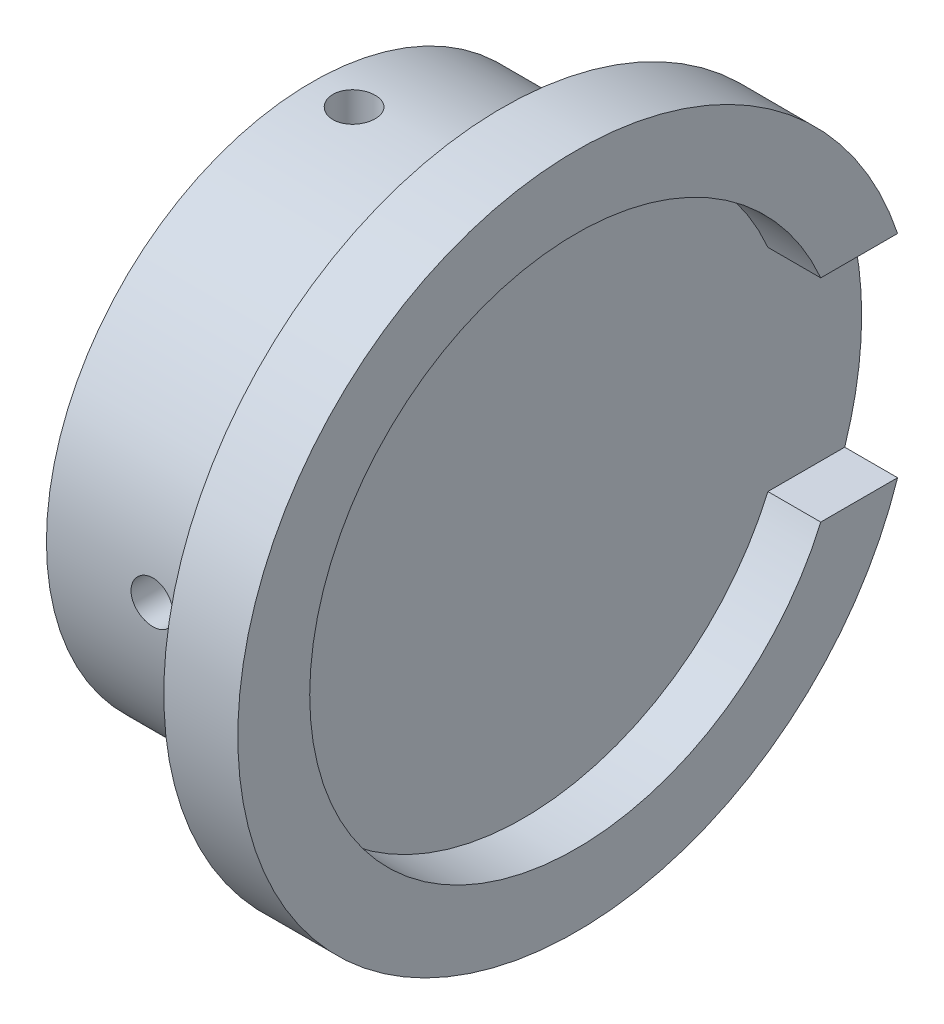
from build123d import *

# Parameters (mm, degrees)
SKETCH_1_R                      = 12.55
EXTRUDE_1_DEPTH                 = 10
SKETCH_2_R                      = 3
CUT_EXTRUDE_1_DEPTH             = 7
CUT_EXTRUDE_2_REACH             = 22.372
SKETCH_3_R                      = 1
CUT_EXTRUDE_2_DIRECTION_2_REACH = 22.372
CUT_EXTRUDE_3_DEPTH             = 21
CUT_EXTRUDE_3_DEPTH_BACK        = 19
SKETCH_4_R                      = 1
EXTRUDE_2_DEPTH                 = 2.5
EXTRUDE_2_DEPTH_BACK            = 1
SKETCH_5_R                      = 16
SKETCH_6_R                      = 12.6
CUT_EXTRUDE_4_DEPTH             = 2.5
FILLET_1_R                      = 2
SKETCH_7_W                      = 2.5
SKETCH_7_H                      = 10
CUT_EXTRUDE_5_DEPTH             = 21.5


with BuildPart() as part:
    # 草图1 → 凸台-拉伸1 (new body)
    with BuildSketch(Plane(origin=(0, 0, 0), x_dir=(0, 0, -1), z_dir=(1, 0, 0))):
        Circle(SKETCH_1_R)
    extrude(amount=EXTRUDE_1_DEPTH)

    # 草图2 → 切除-拉伸1 (cut)
    with BuildSketch(Plane.ZY):
        Circle(SKETCH_2_R)
    extrude(amount=-CUT_EXTRUDE_1_DEPTH, mode=Mode.SUBTRACT)

    # 草图3 → 切除-拉伸2 (cut, up to next)
    with BuildSketch(Plane(origin=(0, 0, 0), x_dir=(1, 0, 0), z_dir=(0, 1, 0)), mode=Mode.PRIVATE) as cut_extrude_2_sk1:
        with Locations(Location((2, 0, 0), (0, 0, 270))):
            Circle(SKETCH_3_R)
    cut_extrude_2_tool1 = extrude(cut_extrude_2_sk1.sketch, amount=-CUT_EXTRUDE_2_REACH, mode=Mode.PRIVATE) & part.part
    add(cut_extrude_2_tool1.solids().sort_by_distance((2, 0, 0))[0], mode=Mode.SUBTRACT)

    # 草图3 → 切除-拉伸2 direction 2 (cut, up to next)
    with BuildSketch(Plane(origin=(0, 0, 0), x_dir=(1, 0, 0), z_dir=(0, 1, 0)), mode=Mode.PRIVATE) as cut_extrude_2_direction_2_sk1:
        with Locations(Location((2, 0, 0), (0, 0, 270))):
            Circle(SKETCH_3_R)
    cut_extrude_2_direction_2_tool1 = extrude(cut_extrude_2_direction_2_sk1.sketch, amount=CUT_EXTRUDE_2_DIRECTION_2_REACH, mode=Mode.PRIVATE) & part.part
    add(cut_extrude_2_direction_2_tool1.solids().sort_by_distance((2, 0, 0))[0], mode=Mode.SUBTRACT)

    # 草图4 → 切除-拉伸3 (cut, two sides: drawn at the far end of the back side and taken through both)
    with BuildSketch(Plane.XY.offset(-CUT_EXTRUDE_3_DEPTH_BACK)):
        with Locations(Location((5, 0, 0), (0, 0, 180))):
            Circle(SKETCH_4_R)
    extrude(amount=CUT_EXTRUDE_3_DEPTH + CUT_EXTRUDE_3_DEPTH_BACK, mode=Mode.SUBTRACT)

    # 草图5 → 凸台-拉伸2 (add, two sides: drawn at the far end of the back side and taken through both)
    with BuildSketch(Plane(origin=(10, 0, 0), x_dir=(0, 0, -1), z_dir=(1, 0, 0)).offset(-EXTRUDE_2_DEPTH_BACK)):
        Circle(SKETCH_5_R)
    extrude(amount=EXTRUDE_2_DEPTH + EXTRUDE_2_DEPTH_BACK)

    # 草图6 → 切除-拉伸4 (cut)
    with BuildSketch(Plane(origin=(12.5, 0, 0), x_dir=(0, 0, -1), z_dir=(1, 0, 0))):
        Circle(SKETCH_6_R)
    extrude(amount=-CUT_EXTRUDE_4_DEPTH, mode=Mode.SUBTRACT)

    # 圆角1
    fillet_1_edges = [part.edges().sort_by_distance(p)[0] for p in [
        (9, 0, 12.55),
    ]]
    fillet(fillet_1_edges, radius=FILLET_1_R)

    # 草图7 → 切除-拉伸5 (cut)
    with BuildSketch(Plane.XY):
        with Locations((11.25, 0)):
            Rectangle(SKETCH_7_W, SKETCH_7_H)
    extrude(amount=-CUT_EXTRUDE_5_DEPTH, mode=Mode.SUBTRACT)


solid = part.part
